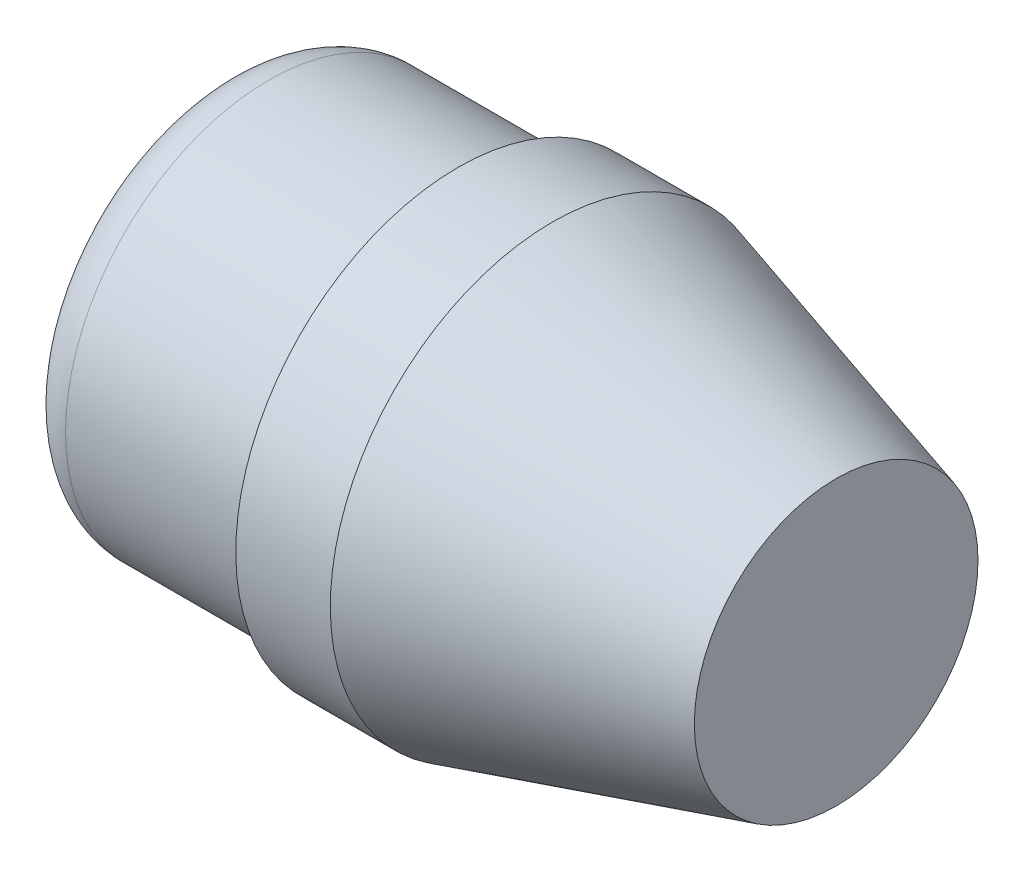
from build123d import *

# Parameters (mm, degrees)
FILETE1_R = 1


with BuildPart() as part:
    # Esboço1 → Revolução1 (revolve)
    with BuildSketch(Plane.XY):
        Polygon((0, 0), (0, 4.3), (5, 4.3), (5, 4.7), (7, 4.7), (13, 3), (13, 0), align=None)
    revolve(axis=Axis((13, 0, 0), (-1, 0, 0)))

    # Filete1
    filete1_edges = [part.edges().sort_by_distance(p)[0] for p in [
        (0, -4.3, 0),
    ]]
    fillet(filete1_edges, radius=FILETE1_R)


solid = part.part
